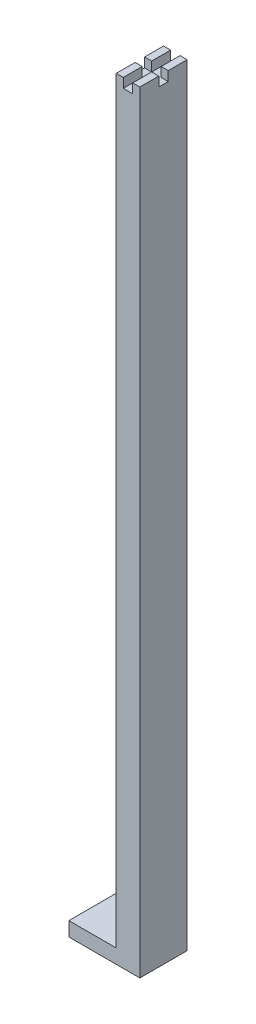
from build123d import *

# Parameters (mm, degrees)
SKETCH1_W           = 15
SKETCH1_H           = 10
BOSS_EXTRUDE1_DEPTH = 3
SKETCH2_W           = 5
SKETCH2_H           = 10
BOSS_EXTRUDE2_DEPTH = 160
CUT_EXTRUDE1_DEPTH  = 2


with BuildPart() as part:
    # Sketch1 → Boss-Extrude1 (new body)
    with BuildSketch(Plane(origin=(0, 0, 0), x_dir=(1, 0, 0), z_dir=(0, 1, 0))):
        Rectangle(SKETCH1_W, SKETCH1_H)
    extrude(amount=BOSS_EXTRUDE1_DEPTH)

    # Sketch2 → Boss-Extrude2 (add)
    with BuildSketch(Plane(origin=(0, 3, 0), x_dir=(1, 0, 0), z_dir=(0, 1, 0))):
        with Locations((5, 0)):
            Rectangle(SKETCH2_W, SKETCH2_H)
    extrude(amount=BOSS_EXTRUDE2_DEPTH)

    # Sketch3 → Cut-Extrude1 (cut)
    with BuildSketch(Plane(origin=(0, 163, 0), x_dir=(1, 0, 0), z_dir=(0, 1, 0))):
        Polygon((4, -1), (2.5, -1), (2.5, 1), (4, 1), (4, 5), (6, 5), (6, 1), (7.5, 1), (7.5, -1), (6, -1), (6, -5), (4, -5), align=None)
    extrude(amount=-CUT_EXTRUDE1_DEPTH, mode=Mode.SUBTRACT)


solid = part.part
